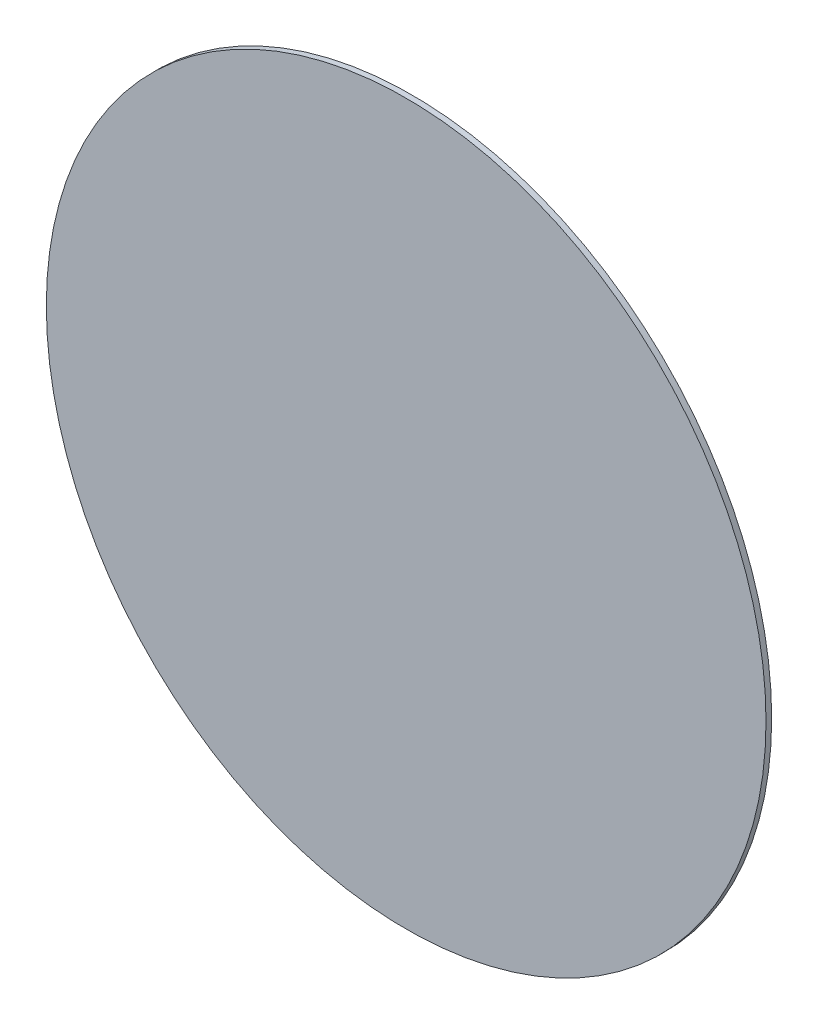
from build123d import *

# Parameters (mm, degrees)
SKETCH2_R           = 63.5
BOSS_EXTRUDE1_DEPTH = 1


with BuildPart() as part:
    # Sketch2 → Boss-Extrude1 (new body)
    with BuildSketch(Plane.XY):
        Circle(SKETCH2_R)
    extrude(amount=BOSS_EXTRUDE1_DEPTH)


solid = part.part
